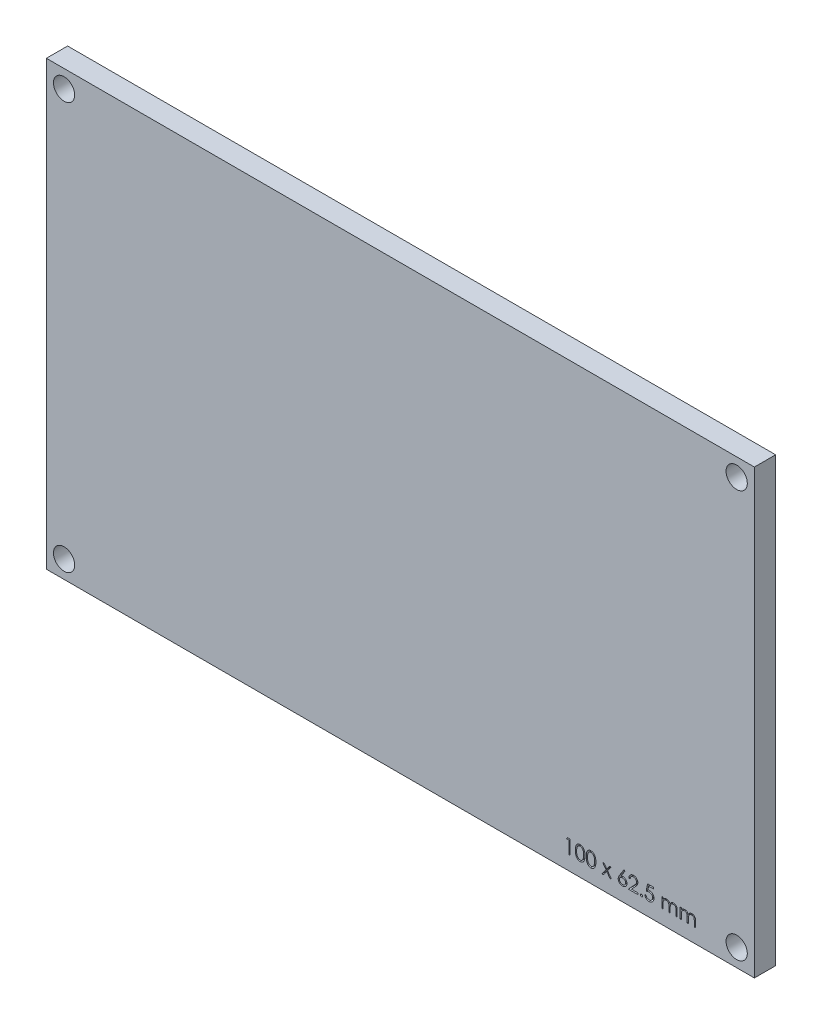
from build123d import *

# Parameters (mm, degrees)
SKETCH1_W               = 100
SKETCH1_H               = 62.5
BOSS_EXTRUDE1_DEPTH     = 3
CUT_EXTRUDE1_DEPTH      = 60.038652593
CUT_EXTRUDE1_DEPTH_BACK = 60.038652593
SKETCH2_R               = 1.5
CUT_EXTRUDE2_DEPTH      = 1


with BuildPart() as part:
    # Sketch1 → Boss-Extrude1 (new body)
    with BuildSketch(Plane.XY):
        Rectangle(SKETCH1_W, SKETCH1_H)
    extrude(amount=BOSS_EXTRUDE1_DEPTH)

    # Sketch2 → Cut-Extrude1 (cut, two sides: drawn at the far end of the back side and taken through both)
    with BuildSketch(Plane.XY.offset(3).offset(-CUT_EXTRUDE1_DEPTH_BACK)):
        with Locations((-47.5, 28.75)):
            Circle(SKETCH2_R)
        with Locations((-47.5, -28.75)):
            Circle(SKETCH2_R)
        with Locations((47.5, -28.75)):
            Circle(SKETCH2_R)
        with Locations((47.5, 28.75)):
            Circle(SKETCH2_R)
    extrude(amount=CUT_EXTRUDE1_DEPTH + CUT_EXTRUDE1_DEPTH_BACK, mode=Mode.SUBTRACT)

    # Sketch4 → Cut-Extrude2 (cut)
    # profile 1 of 10: a face of its own
    with BuildSketch(Plane.XY.offset(3)):
        Polygon((23.601670202, -27.27377154), (23.971461869, -27.27377154), (23.971461869, -29.27377154), (23.791974689, -29.27377154), (23.791974689, -27.478899745), (23.484282382, -27.478899745), align=None)
    # profile 2 of 10: a face of its own
    with BuildSketch(Plane.XY.offset(3)):
        with BuildLine():
            add(Edge.make_bspline(
                [(24.715051613, -28.274572822), (24.715239051, -28.242517172), (24.715603154, -28.18024861), (24.719653681, -28.089514528), (24.726382448, -28.004394363), (24.735603804, -27.92488404), (24.746825507, -27.850963032), (24.761805785, -27.782828885), (24.778841672, -27.720166252), (24.798585927, -27.662770796), (24.820864663, -27.609869251), (24.845112812, -27.560483422), (24.872292695, -27.514688032), (24.900850931, -27.471752152), (24.931943543, -27.432378612), (24.964685709, -27.396011376), (25.000355353, -27.363490948), (25.037739929, -27.333864489), (25.077177908, -27.307893362), (25.117545146, -27.285017512), (25.159119492, -27.26547473), (25.202014454, -27.250108767), (25.245844487, -27.237416855), (25.290762811, -27.228737456), (25.33684359, -27.223276365), (25.367947267, -27.22275427), (25.383721484, -27.222489489)],
                knots=[0, 0, 0, 0, 1.646270934, 3.197905019, 4.663502075, 6.030701355, 7.308322542, 8.50163776, 9.611534131, 10.641858119, 11.616356847, 12.558055219, 13.465016945, 14.349605745, 15.204443733, 16.039544428, 16.859896111, 17.680448484, 18.487036065, 19.28249412, 20.06191084, 20.843045899, 21.620316918, 22.403196591, 23.190181807, 24, 24, 24, 24], degree=3))
            add(Edge.make_bspline(
                [(25.383721484, -27.222489489), (25.399627472, -27.22276824), (25.431259477, -27.22332259), (25.478025406, -27.228650557), (25.523710938, -27.237491198), (25.568121303, -27.25001747), (25.611621295, -27.265557856), (25.653870671, -27.285036209), (25.695131861, -27.307709847), (25.734749168, -27.334352063), (25.77315752, -27.364056221), (25.809413498, -27.397634889), (25.843520405, -27.434749014), (25.875906293, -27.475001508), (25.905652349, -27.519164413), (25.933980025, -27.566469619), (25.959335474, -27.617744399), (25.983755288, -27.672133238), (26.004833566, -27.731141043), (26.023842849, -27.794435191), (26.03920226, -27.862763298), (26.05199613, -27.935766867), (26.061907499, -28.013714), (26.069126151, -28.096437609), (26.072939343, -28.183992118), (26.073657458, -28.243853746), (26.074025972, -28.274572822)],
                knots=[0, 0, 0, 0, 0.810914788, 1.612654377, 2.396697861, 3.181598691, 3.963628158, 4.749916497, 5.551656086, 6.361998678, 7.18212741, 8.025565596, 8.878627764, 9.750805457, 10.657531673, 11.591944965, 12.560506719, 13.57287815, 14.630710178, 15.753379473, 16.941251878, 18.199788006, 19.531962791, 20.947069417, 22.433333509, 24, 24, 24, 24], degree=3))
            add(Edge.make_bspline(
                [(26.074025972, -28.274572822), (26.073653637, -28.305157912), (26.07292816, -28.364751714), (26.069168899, -28.451912271), (26.061763967, -28.534196867), (26.052501116, -28.611802846), (26.039671995, -28.684407199), (26.023897614, -28.75226117), (26.006383144, -28.815657782), (25.984763261, -28.874077674), (25.961099998, -28.928335802), (25.935354172, -28.979002744), (25.907771414, -29.02652634), (25.877720703, -29.070526195), (25.845690181, -29.111313999), (25.810994302, -29.148169783), (25.77461111, -29.181981596), (25.73608973, -29.21206824), (25.695854557, -29.238402414), (25.654735085, -29.261953186), (25.612001723, -29.280943297), (25.568622893, -29.297249035), (25.523978112, -29.309706436), (25.478123032, -29.318320068), (25.431290897, -29.324361124), (25.39963286, -29.32482197), (25.383721484, -29.325053591)],
                knots=[0, 0, 0, 0, 1.561518951, 3.042555995, 4.452378317, 5.7783523, 7.031515105, 8.214008947, 9.334062868, 10.386615937, 11.391082383, 12.354592575, 13.286541444, 14.194233754, 15.072674879, 15.931287219, 16.775624067, 17.606195743, 18.42308326, 19.229000347, 20.022332153, 20.807536673, 21.593273796, 22.3848459, 23.188221202, 24, 24, 24, 24], degree=3))
            add(Edge.make_bspline(
                [(25.383721484, -29.325053591), (25.367947705, -29.324787103), (25.336844891, -29.324261639), (25.290757791, -29.318825221), (25.246024966, -29.310084933), (25.202425678, -29.297846874), (25.15973624, -29.282866967), (25.118538362, -29.263350577), (25.078373972, -29.240873966), (25.039350225, -29.215276582), (25.002200419, -29.185949906), (24.966715502, -29.15351317), (24.933786919, -29.117156935), (24.903138865, -29.077455264), (24.874010814, -29.034773411), (24.847216887, -28.988528627), (24.822433542, -28.938904278), (24.799780118, -28.885579758), (24.779695168, -28.827776942), (24.76195362, -28.764834554), (24.74794553, -28.696197048), (24.73595527, -28.622415695), (24.726284194, -28.543173449), (24.719681722, -28.45842729), (24.715600971, -28.368230028), (24.715238074, -28.306361585), (24.715051613, -28.274572822)],
                knots=[0, 0, 0, 0, 0.810891512, 1.598919785, 2.382837074, 3.152667961, 3.926044502, 4.706494248, 5.493654104, 6.291793342, 7.103789334, 7.925228297, 8.761435821, 9.622817696, 10.50288917, 11.416980706, 12.369136599, 13.353924996, 14.394355917, 15.514179734, 16.714354668, 17.994756427, 19.357759367, 20.818452758, 22.365282078, 24, 24, 24, 24], degree=3))
        make_face()
        with BuildLine():
            add(Edge.make_bspline(
                [(24.894538792, -28.27377154), (24.894607047, -28.300485082), (24.894739518, -28.352330822), (24.898200204, -28.427669828), (24.902914622, -28.497938588), (24.908995364, -28.563226323), (24.91802562, -28.623312044), (24.928143784, -28.678609006), (24.940456978, -28.72882457), (24.95502556, -28.774303319), (24.97161933, -28.815817073), (24.989736966, -28.854446338), (25.009200236, -28.890647445), (25.030982608, -28.924095221), (25.054705501, -28.954898743), (25.079833078, -28.983603219), (25.107303126, -29.009201494), (25.145305265, -29.039902554), (25.195474679, -29.071627773), (25.258686367, -29.09925411), (25.323639768, -29.116615514), (25.367726197, -29.118823375), (25.3897311, -29.119925386)],
                knots=[0, 0, 0, 0, 1.459021318, 2.831673884, 4.118529203, 5.306027144, 6.411944654, 7.436330062, 8.375795394, 9.233974572, 10.042671642, 10.816086306, 11.563610507, 12.285937304, 12.993564865, 13.685989202, 14.367179055, 15.041617293, 16.353048772, 17.594441528, 18.799311195, 20, 20, 20, 20], degree=3))
            add(Edge.make_bspline(
                [(25.3897311, -29.119925386), (25.411878341, -29.119012369), (25.456127097, -29.117188219), (25.52077498, -29.09958894), (25.583535134, -29.073034917), (25.6327191, -29.041636343), (25.670137696, -29.01173444), (25.696947405, -28.986240356), (25.72155429, -28.957694146), (25.744892618, -28.926894548), (25.766297804, -28.893253129), (25.785762454, -28.856931657), (25.803524367, -28.81782927), (25.813643822, -28.790532276), (25.818817638, -28.776576027)],
                knots=[0, 0, 0, 0, 1.353760809, 2.704726607, 4.075137775, 5.516104923, 6.260822281, 7.007110065, 7.778089737, 8.566572457, 9.372053459, 10.217411131, 11.088608312, 12, 12, 12, 12], degree=3))
            add(Edge.make_bspline(
                [(25.818817638, -28.776576027), (25.82484722, -28.758730462), (25.837089856, -28.722496311), (25.852868013, -28.66628851), (25.865293955, -28.607315502), (25.876473022, -28.545929721), (25.884103339, -28.481678463), (25.890244947, -28.414760529), (25.893862482, -28.345125465), (25.894310911, -28.297814042), (25.894538792, -28.27377154)],
                knots=[0, 0, 0, 0, 0.884706709, 1.796334032, 2.740027952, 3.714592787, 4.726048262, 5.777819803, 6.87074269, 8, 8, 8, 8], degree=3))
            add(Edge.make_bspline(
                [(25.894538792, -28.27377154), (25.894224398, -28.249732927), (25.893609377, -28.202708262), (25.891258526, -28.13384073), (25.885187912, -28.068430581), (25.878445559, -28.006196025), (25.86850429, -27.947481566), (25.857785543, -27.891795678), (25.84338485, -27.839828235), (25.828002122, -27.790765617), (25.810396181, -27.745165243), (25.791015762, -27.702814508), (25.770317614, -27.663508951), (25.747836334, -27.627356413), (25.7238388, -27.59419496), (25.697691629, -27.564689477), (25.670431988, -27.537925495), (25.632250739, -27.507375456), (25.58226543, -27.476225915), (25.520067918, -27.447559767), (25.455341835, -27.431097885), (25.411585576, -27.428776921), (25.3897311, -27.427617694)],
                knots=[0, 0, 0, 0, 1.31362396, 2.569729283, 3.763502607, 4.902122613, 5.988968491, 7.01645872, 7.998833611, 8.933434873, 9.825090667, 10.667526885, 11.477055099, 12.250526234, 12.991942729, 13.710640831, 14.402115721, 15.076753259, 16.378508321, 17.609869233, 18.806226677, 20, 20, 20, 20], degree=3))
            add(Edge.make_bspline(
                [(25.3897311, -27.427617694), (25.367610761, -27.428778521), (25.323329787, -27.431102289), (25.257930955, -27.447498434), (25.195242755, -27.476077271), (25.145389626, -27.507478627), (25.107181748, -27.537386234), (25.080277352, -27.56332135), (25.055050968, -27.591690638), (25.031812282, -27.622777447), (25.010046977, -27.656186228), (24.990057827, -27.692179808), (24.972047925, -27.730940588), (24.95542819, -27.772435694), (24.940815168, -27.817910519), (24.928761475, -27.86806423), (24.917626016, -27.923185311), (24.909743005, -27.983596458), (24.902735144, -28.048900546), (24.898231517, -28.119344727), (24.894727941, -28.194810088), (24.894603105, -28.246923893), (24.894538792, -28.27377154)],
                knots=[0, 0, 0, 0, 1.207732386, 2.417664972, 3.655092373, 4.956220595, 5.625982001, 6.301752483, 6.994047911, 7.697131622, 8.419323945, 9.170223765, 9.943494443, 10.752040957, 11.610060368, 12.549350801, 13.567764191, 14.679664412, 15.874934091, 17.154273443, 18.533957287, 20, 20, 20, 20], degree=3))
        make_face(mode=Mode.SUBTRACT)
    # profile 3 of 10: a face of its own
    with BuildSketch(Plane.XY.offset(3)):
        with BuildLine():
            add(Edge.make_bspline(
                [(26.253513151, -28.274572822), (26.25370059, -28.242517172), (26.254064693, -28.18024861), (26.258115219, -28.089514528), (26.264843986, -28.004394363), (26.274065342, -27.92488404), (26.285287045, -27.850963032), (26.300267323, -27.782828885), (26.31730321, -27.720166252), (26.337047465, -27.662770796), (26.359326202, -27.609869251), (26.383574351, -27.560483422), (26.410754233, -27.514688032), (26.439312469, -27.471752152), (26.470405081, -27.432378612), (26.503147247, -27.396011376), (26.538816891, -27.363490948), (26.576201467, -27.333864489), (26.615639447, -27.307893362), (26.656006685, -27.285017512), (26.697581031, -27.26547473), (26.740475992, -27.250108767), (26.784306026, -27.237416855), (26.829224349, -27.228737456), (26.875305129, -27.223276365), (26.906408806, -27.22275427), (26.922183023, -27.222489489)],
                knots=[0, 0, 0, 0, 1.646270934, 3.197905019, 4.663502075, 6.030701355, 7.308322542, 8.50163776, 9.611534131, 10.641858119, 11.616356847, 12.558055219, 13.465016945, 14.349605745, 15.204443733, 16.039544428, 16.859896111, 17.680448484, 18.487036065, 19.28249412, 20.06191084, 20.843045899, 21.620316918, 22.403196591, 23.190181807, 24, 24, 24, 24], degree=3))
            add(Edge.make_bspline(
                [(26.922183023, -27.222489489), (26.93808901, -27.22276824), (26.969721016, -27.22332259), (27.016486944, -27.228650557), (27.062172477, -27.237491198), (27.106582842, -27.25001747), (27.150082834, -27.265557856), (27.19233221, -27.285036209), (27.233593399, -27.307709847), (27.273210706, -27.334352063), (27.311619058, -27.364056221), (27.347875037, -27.397634889), (27.381981943, -27.434749014), (27.414367832, -27.475001508), (27.444113887, -27.519164413), (27.472441563, -27.566469619), (27.497797012, -27.617744399), (27.522216826, -27.672133238), (27.543295105, -27.731141043), (27.562304388, -27.794435191), (27.577663798, -27.862763298), (27.590457668, -27.935766867), (27.600369037, -28.013714), (27.60758769, -28.096437609), (27.611400881, -28.183992118), (27.612118996, -28.243853746), (27.61248751, -28.274572822)],
                knots=[0, 0, 0, 0, 0.810914788, 1.612654377, 2.396697861, 3.181598691, 3.963628158, 4.749916497, 5.551656086, 6.361998678, 7.18212741, 8.025565596, 8.878627764, 9.750805457, 10.657531673, 11.591944965, 12.560506719, 13.57287815, 14.630710178, 15.753379473, 16.941251878, 18.199788006, 19.531962791, 20.947069417, 22.433333509, 24, 24, 24, 24], degree=3))
            add(Edge.make_bspline(
                [(27.61248751, -28.274572822), (27.612115176, -28.305157912), (27.611389698, -28.364751714), (27.607630437, -28.451912271), (27.600225505, -28.534196867), (27.590962655, -28.611802846), (27.578133533, -28.684407199), (27.562359152, -28.75226117), (27.544844682, -28.815657782), (27.5232248, -28.874077674), (27.499561537, -28.928335802), (27.47381571, -28.979002744), (27.446232953, -29.02652634), (27.416182241, -29.070526195), (27.384151719, -29.111313999), (27.34945584, -29.148169783), (27.313072649, -29.181981596), (27.274551268, -29.21206824), (27.234316096, -29.238402414), (27.193196623, -29.261953186), (27.150463261, -29.280943297), (27.107084431, -29.297249035), (27.062439651, -29.309706436), (27.01658457, -29.318320068), (26.969752435, -29.324361124), (26.938094398, -29.32482197), (26.922183023, -29.325053591)],
                knots=[0, 0, 0, 0, 1.561518951, 3.042555995, 4.452378317, 5.7783523, 7.031515105, 8.214008947, 9.334062868, 10.386615937, 11.391082383, 12.354592575, 13.286541444, 14.194233754, 15.072674879, 15.931287219, 16.775624067, 17.606195743, 18.42308326, 19.229000347, 20.022332153, 20.807536673, 21.593273796, 22.3848459, 23.188221202, 24, 24, 24, 24], degree=3))
            add(Edge.make_bspline(
                [(26.922183023, -29.325053591), (26.906409243, -29.324787103), (26.875306429, -29.324261639), (26.829219329, -29.318825221), (26.784486504, -29.310084933), (26.740887216, -29.297846874), (26.698197779, -29.282866967), (26.656999901, -29.263350577), (26.61683551, -29.240873966), (26.577811764, -29.215276582), (26.540661958, -29.185949906), (26.50517704, -29.15351317), (26.472248458, -29.117156935), (26.441600403, -29.077455264), (26.412472353, -29.034773411), (26.385678425, -28.988528627), (26.36089508, -28.938904278), (26.338241657, -28.885579758), (26.318156706, -28.827776942), (26.300415159, -28.764834554), (26.286407069, -28.696197048), (26.274416809, -28.622415695), (26.264745733, -28.543173449), (26.258143261, -28.45842729), (26.254062509, -28.368230028), (26.253699612, -28.306361585), (26.253513151, -28.274572822)],
                knots=[0, 0, 0, 0, 0.810891512, 1.598919785, 2.382837074, 3.152667961, 3.926044502, 4.706494248, 5.493654104, 6.291793342, 7.103789334, 7.925228297, 8.761435821, 9.622817696, 10.50288917, 11.416980706, 12.369136599, 13.353924996, 14.394355917, 15.514179734, 16.714354668, 17.994756427, 19.357759367, 20.818452758, 22.365282078, 24, 24, 24, 24], degree=3))
        make_face()
        with BuildLine():
            add(Edge.make_bspline(
                [(26.43300033, -28.27377154), (26.433068586, -28.300485082), (26.433201056, -28.352330822), (26.436661742, -28.427669828), (26.441376161, -28.497938588), (26.447456902, -28.563226323), (26.456487158, -28.623312044), (26.466605323, -28.678609006), (26.478918517, -28.72882457), (26.493487098, -28.774303319), (26.510080868, -28.815817073), (26.528198504, -28.854446338), (26.547661775, -28.890647445), (26.569444146, -28.924095221), (26.59316704, -28.954898743), (26.618294616, -28.983603219), (26.645764665, -29.009201494), (26.683766803, -29.039902554), (26.733936217, -29.071627773), (26.797147906, -29.09925411), (26.862101306, -29.116615514), (26.906187735, -29.118823375), (26.928192638, -29.119925386)],
                knots=[0, 0, 0, 0, 1.459021318, 2.831673884, 4.118529203, 5.306027144, 6.411944654, 7.436330062, 8.375795394, 9.233974572, 10.042671642, 10.816086306, 11.563610507, 12.285937304, 12.993564865, 13.685989202, 14.367179055, 15.041617293, 16.353048772, 17.594441528, 18.799311195, 20, 20, 20, 20], degree=3))
            add(Edge.make_bspline(
                [(26.928192638, -29.119925386), (26.950339879, -29.119012369), (26.994588635, -29.117188219), (27.059236518, -29.09958894), (27.121996673, -29.073034917), (27.171180638, -29.041636343), (27.208599235, -29.01173444), (27.235408943, -28.986240356), (27.260015828, -28.957694146), (27.283354157, -28.926894548), (27.304759343, -28.893253129), (27.324223993, -28.856931657), (27.341985906, -28.81782927), (27.352105361, -28.790532276), (27.357279177, -28.776576027)],
                knots=[0, 0, 0, 0, 1.353760809, 2.704726607, 4.075137775, 5.516104923, 6.260822281, 7.007110065, 7.778089737, 8.566572457, 9.372053459, 10.217411131, 11.088608312, 12, 12, 12, 12], degree=3))
            add(Edge.make_bspline(
                [(27.357279177, -28.776576027), (27.363308758, -28.758730462), (27.375551395, -28.722496311), (27.391329551, -28.66628851), (27.403755494, -28.607315502), (27.41493456, -28.545929721), (27.422564878, -28.481678463), (27.428706485, -28.414760529), (27.432324021, -28.345125465), (27.43277245, -28.297814042), (27.43300033, -28.27377154)],
                knots=[0, 0, 0, 0, 0.884706709, 1.796334032, 2.740027952, 3.714592787, 4.726048262, 5.777819803, 6.87074269, 8, 8, 8, 8], degree=3))
            add(Edge.make_bspline(
                [(27.43300033, -28.27377154), (27.432685937, -28.249732927), (27.432070915, -28.202708262), (27.429720065, -28.13384073), (27.423649451, -28.068430581), (27.416907097, -28.006196025), (27.406965828, -27.947481566), (27.396247081, -27.891795678), (27.381846389, -27.839828235), (27.36646366, -27.790765617), (27.34885772, -27.745165243), (27.3294773, -27.702814508), (27.308779152, -27.663508951), (27.286297872, -27.627356413), (27.262300339, -27.59419496), (27.236153168, -27.564689477), (27.208893526, -27.537925495), (27.170712277, -27.507375456), (27.120726969, -27.476225915), (27.058529456, -27.447559767), (26.993803374, -27.431097885), (26.950047114, -27.428776921), (26.928192638, -27.427617694)],
                knots=[0, 0, 0, 0, 1.31362396, 2.569729283, 3.763502607, 4.902122613, 5.988968491, 7.01645872, 7.998833611, 8.933434873, 9.825090667, 10.667526885, 11.477055099, 12.250526234, 12.991942729, 13.710640831, 14.402115721, 15.076753259, 16.378508321, 17.609869233, 18.806226677, 20, 20, 20, 20], degree=3))
            add(Edge.make_bspline(
                [(26.928192638, -27.427617694), (26.9060723, -27.428778521), (26.861791325, -27.431102289), (26.796392494, -27.447498434), (26.733704293, -27.476077271), (26.683851165, -27.507478627), (26.645643287, -27.537386234), (26.61873889, -27.56332135), (26.593512506, -27.591690638), (26.57027382, -27.622777447), (26.548508516, -27.656186228), (26.528519366, -27.692179808), (26.510509463, -27.730940588), (26.493889728, -27.772435694), (26.479276706, -27.817910519), (26.467223013, -27.86806423), (26.456087554, -27.923185311), (26.448204543, -27.983596458), (26.441196683, -28.048900546), (26.436693056, -28.119344727), (26.43318948, -28.194810088), (26.433064643, -28.246923893), (26.43300033, -28.27377154)],
                knots=[0, 0, 0, 0, 1.207732386, 2.417664972, 3.655092373, 4.956220595, 5.625982001, 6.301752483, 6.994047911, 7.697131622, 8.419323945, 9.170223765, 9.943494443, 10.752040957, 11.610060368, 12.549350801, 13.567764191, 14.679664412, 15.874934091, 17.154273443, 18.533957287, 20, 20, 20, 20], degree=3))
        make_face(mode=Mode.SUBTRACT)
    # profile 4 of 10: a face of its own
    with BuildSketch(Plane.XY.offset(3)):
        Polygon((28.561205459, -27.812233079), (28.774747125, -27.812233079), (29.150949048, -28.339476668), (29.527150972, -27.812233079), (29.740692638, -27.812233079), (29.257920202, -28.488915771), (29.817615715, -29.27377154), (29.604074048, -29.27377154), (29.150949048, -28.638755515), (28.697824048, -29.27377154), (28.484282382, -29.27377154), (29.044378536, -28.488915771), align=None)
    # profile 5 of 10: a face of its own
    with BuildSketch(Plane.XY.offset(3)):
        with BuildLine():
            Line((31.586846484, -27.222489489), (31.725067638, -27.331063207))
            Line((31.725067638, -27.331063207), (31.196622125, -28.139156156))
            add(Edge.make_bspline(
                [(31.196622125, -28.139156156), (31.231805141, -28.133548235), (31.30043359, -28.122609352), (31.369899818, -28.120804812), (31.403753536, -28.119925386)],
                knots=[0, 0, 0, 0, 1.025318673, 2, 2, 2, 2], degree=3))
            add(Edge.make_bspline(
                [(31.403753536, -28.119925386), (31.424080676, -28.120471736), (31.464094048, -28.121547209), (31.522840792, -28.129823695), (31.579291613, -28.142866616), (31.633212534, -28.161879334), (31.684797095, -28.186166393), (31.734341321, -28.215274319), (31.780913899, -28.250706136), (31.825114572, -28.290286111), (31.865244342, -28.334124388), (31.900773517, -28.380639438), (31.930617398, -28.429782798), (31.954831067, -28.481529579), (31.973633855, -28.535800013), (31.987341081, -28.592524664), (31.995443705, -28.651742648), (31.996543986, -28.692015891), (31.997102895, -28.712473463)],
                knots=[0, 0, 0, 0, 1.04369286, 2.054478336, 3.041073146, 4.015093852, 4.984733326, 5.965804835, 6.960378782, 7.985147595, 9.009457201, 10.008161701, 10.986880575, 11.956520048, 12.937015923, 13.931873656, 14.949455224, 16, 16, 16, 16], degree=3))
            add(Edge.make_bspline(
                [(31.997102895, -28.712473463), (31.996289692, -28.740461866), (31.994689501, -28.795536417), (31.978744475, -28.875751678), (31.953967535, -28.952170259), (31.918551804, -29.023572071), (31.874561871, -29.089859253), (31.820917533, -29.148593805), (31.759521254, -29.200976684), (31.690100226, -29.244780466), (31.615389961, -29.280553638), (31.536903105, -29.306248062), (31.455401879, -29.322067187), (31.40008496, -29.324050389), (31.372102895, -29.325053591)],
                knots=[0, 0, 0, 0, 1.031375318, 2.029502543, 3.004789286, 3.987476834, 4.960371455, 5.9300674, 6.912260825, 7.929083631, 8.949397511, 9.960523116, 10.96833055, 12, 12, 12, 12], degree=3))
            add(Edge.make_bspline(
                [(31.372102895, -29.325053591), (31.345190494, -29.324180331), (31.291881741, -29.322450555), (31.213463002, -29.307041448), (31.138112706, -29.28206596), (31.066358774, -29.247657801), (30.999889852, -29.204196154), (30.940423774, -29.151874851), (30.888257046, -29.0918123), (30.844842977, -29.024017816), (30.810409416, -28.951166412), (30.784586601, -28.875202322), (30.769503034, -28.796402333), (30.767395287, -28.742984539), (30.766333664, -28.716079232)],
                knots=[0, 0, 0, 0, 1.012016664, 2.004627821, 2.994792927, 3.992885782, 4.990978636, 5.973936114, 6.964471063, 7.975201453, 8.993600317, 9.990122807, 10.98767138, 12, 12, 12, 12], degree=3))
            add(Edge.make_bspline(
                [(30.766333664, -28.716079232), (30.767008775, -28.695482328), (30.768387224, -28.653427384), (30.778012018, -28.589733654), (30.793477615, -28.524561607), (30.810797756, -28.469273496), (30.829098105, -28.423981198), (30.844328127, -28.387464918), (30.863284696, -28.349887161), (30.883498057, -28.309959369), (30.906787697, -28.268710551), (30.932110925, -28.225451311), (30.960167868, -28.180869638), (30.979836533, -28.150615812), (30.989891356, -28.135149745)],
                knots=[0, 0, 0, 0, 1.173818275, 2.396712641, 3.66331629, 4.989737886, 5.693666774, 6.447286557, 7.243889047, 8.091586357, 8.998013824, 9.943181721, 10.948533338, 12, 12, 12, 12], degree=3))
            Line((30.989891356, -28.135149745), (31.586846484, -27.222489489))
        make_face()
        with BuildLine():
            add(Edge.make_bspline(
                [(31.366093279, -28.325053591), (31.350857711, -28.325498188), (31.32109822, -28.326366614), (31.27743684, -28.331409615), (31.236114982, -28.340906224), (31.196585191, -28.353001271), (31.159586504, -28.36963159), (31.124850024, -28.389832618), (31.092241423, -28.413616149), (31.06210225, -28.440645241), (31.034776728, -28.470238403), (31.011244654, -28.501935272), (30.990946139, -28.53497196), (30.974442243, -28.569624498), (30.961590771, -28.605879641), (30.952294628, -28.643570641), (30.947121056, -28.682950244), (30.946260352, -28.709654531), (30.945820843, -28.723290771)],
                knots=[0, 0, 0, 0, 1.129588631, 2.206414736, 3.251139165, 4.268635594, 5.265702196, 6.250456724, 7.242448911, 8.251968645, 9.246821453, 10.222880186, 11.173611482, 12.116736599, 13.062300278, 14.020270554, 14.989073742, 16, 16, 16, 16], degree=3))
            add(Edge.make_bspline(
                [(30.945820843, -28.723290771), (30.946178764, -28.736805045), (30.946880594, -28.763304525), (30.953253348, -28.802355485), (30.962987681, -28.839935432), (30.977467907, -28.875850632), (30.994740414, -28.910648528), (31.017543457, -28.943068691), (31.042810191, -28.975080159), (31.073012439, -29.004223857), (31.105425789, -29.031341928), (31.140055048, -29.05504493), (31.176146454, -29.075322744), (31.214187266, -29.0912148), (31.253637771, -29.104257249), (31.294826659, -29.113435237), (31.337782577, -29.118624109), (31.366880827, -29.119485934), (31.381718279, -29.119925386)],
                knots=[0, 0, 0, 0, 0.989467248, 1.94019797, 2.891935182, 3.827694429, 4.772920941, 5.730924762, 6.725747692, 7.756678648, 8.79901574, 9.819492441, 10.826891316, 11.826466727, 12.835195252, 13.867842842, 14.912794438, 16, 16, 16, 16], degree=3))
            add(Edge.make_bspline(
                [(31.381718279, -29.119925386), (31.396555707, -29.1194859), (31.42565391, -29.118624007), (31.468610173, -29.113435625), (31.509797783, -29.104255826), (31.549252931, -29.091219958), (31.587276606, -29.075303609), (31.623336447, -29.055171084), (31.657638214, -29.031196159), (31.690072843, -29.0042702), (31.720149379, -28.974914285), (31.74602211, -28.943354443), (31.768126814, -28.910386503), (31.786089207, -28.875987709), (31.800409945, -28.839913716), (31.810193641, -28.802361302), (31.816553234, -28.763303002), (31.817256872, -28.736804531), (31.817615715, -28.723290771)],
                knots=[0, 0, 0, 0, 1.087397944, 2.132534446, 3.165364764, 4.174271784, 5.174024072, 6.181601208, 7.194203697, 8.236725232, 9.267838612, 10.269026844, 11.221737037, 12.171628256, 13.107553087, 14.05945871, 15.010357665, 16, 16, 16, 16], degree=3))
            add(Edge.make_bspline(
                [(31.817615715, -28.723290771), (31.817301262, -28.709636742), (31.816684093, -28.682838323), (31.809703551, -28.643588256), (31.800022194, -28.605688138), (31.785403319, -28.569376167), (31.766411008, -28.534795637), (31.743277633, -28.501771865), (31.716516164, -28.470051667), (31.685603284, -28.440587205), (31.651951722, -28.413646017), (31.616171387, -28.389863414), (31.57873826, -28.369791998), (31.539690293, -28.353045083), (31.498580074, -28.340959669), (31.456071309, -28.33144353), (31.411620313, -28.32637952), (31.381462251, -28.325501197), (31.366093279, -28.325053591)],
                knots=[0, 0, 0, 0, 0.978206639, 1.919901502, 2.851605144, 3.780102724, 4.718870031, 5.675451981, 6.667674623, 7.690630536, 8.733308323, 9.756129687, 10.767539656, 11.776269907, 12.797430371, 13.836405707, 14.897401972, 16, 16, 16, 16], degree=3))
        make_face(mode=Mode.SUBTRACT)
    # profile 6 of 10: a face of its own
    with BuildSketch(Plane.XY.offset(3)):
        with BuildLine():
            Line((32.458641356, -27.889156156), (32.279154177, -27.889156156))
            add(Edge.make_bspline(
                [(32.279154177, -27.889156156), (32.280323978, -27.86534422), (32.282621438, -27.818578211), (32.29338046, -27.750393122), (32.308775247, -27.685218951), (32.330541792, -27.623579), (32.357573951, -27.564928253), (32.38999111, -27.509499673), (32.428387596, -27.457504708), (32.471934301, -27.409425369), (32.519230666, -27.365318186), (32.570262631, -27.327229476), (32.623888361, -27.295047949), (32.679945161, -27.268144382), (32.739065483, -27.247950185), (32.80071283, -27.232966391), (32.865158051, -27.223951336), (32.909066635, -27.222982316), (32.931397766, -27.222489489)],
                knots=[0, 0, 0, 0, 1.10065271, 2.161652631, 3.183658789, 4.190468796, 5.17591951, 6.163126047, 7.15150782, 8.156236427, 9.156009102, 10.134482811, 11.092018607, 12.041330605, 13.001268258, 13.972401359, 14.968799086, 16, 16, 16, 16], degree=3))
            add(Edge.make_bspline(
                [(32.931397766, -27.222489489), (32.953328094, -27.223002893), (32.996420406, -27.224011712), (33.059312985, -27.232675158), (33.119185725, -27.246244067), (33.175921592, -27.265281448), (33.229067914, -27.290872549), (33.27902394, -27.321614), (33.326384403, -27.357168189), (33.369016851, -27.399027511), (33.408164325, -27.443714588), (33.441937042, -27.491421962), (33.47085885, -27.540695839), (33.494966095, -27.591911954), (33.51271246, -27.645552542), (33.526185722, -27.700836658), (33.533801387, -27.75833655), (33.5349702, -27.797254582), (33.535564433, -27.817040771)],
                knots=[0, 0, 0, 0, 1.111607364, 2.184268762, 3.212621178, 4.221274766, 5.211760367, 6.196651075, 7.1921475, 8.207485113, 9.220403448, 10.201281604, 11.166441695, 12.114753415, 13.065576456, 14.026450734, 14.996634279, 16, 16, 16, 16], degree=3))
            add(Edge.make_bspline(
                [(33.535564433, -27.817040771), (33.534596854, -27.844896676), (33.532678676, -27.900119656), (33.516270461, -27.981271006), (33.490643883, -28.059895817), (33.459788251, -28.123174275), (33.42866114, -28.174164843), (33.400611136, -28.21614696), (33.367774101, -28.261350085), (33.329672102, -28.309622849), (33.287093318, -28.361343366), (33.239652082, -28.416480392), (33.187010092, -28.474464261), (33.150062377, -28.514067461), (33.130916997, -28.534588848)],
                knots=[0, 0, 0, 0, 1.184426356, 2.348067706, 3.509069118, 4.696110526, 5.333549288, 6.050745305, 6.844228056, 7.710549037, 8.667450064, 9.695053472, 10.805634456, 12, 12, 12, 12], degree=3))
            Line((33.130916997, -28.534588848), (32.630516356, -29.068643335))
            Line((32.630516356, -29.068643335), (33.561205459, -29.068643335))
            Line((33.561205459, -29.068643335), (33.561205459, -29.27377154))
            Line((33.561205459, -29.27377154), (32.2022311, -29.27377154))
            Line((32.2022311, -29.27377154), (32.977872125, -28.446047181))
            add(Edge.make_bspline(
                [(32.977872125, -28.446047181), (32.996756632, -28.426333863), (33.033029905, -28.388468614), (33.084334234, -28.333186922), (33.130413656, -28.28190147), (33.171566452, -28.234709157), (33.206899884, -28.19091969), (33.238255445, -28.151951288), (33.26337864, -28.116091602), (33.29064458, -28.074525537), (33.317052569, -28.023775641), (33.339745344, -27.96175639), (33.353582401, -27.897912246), (33.355242307, -27.854768224), (33.356077254, -27.833066412)],
                knots=[0, 0, 0, 0, 1.329631726, 2.553950428, 3.673215718, 4.687767853, 5.603093632, 6.413772471, 7.123043292, 7.734684054, 8.834405432, 9.900288307, 10.943827018, 12, 12, 12, 12], degree=3))
            add(Edge.make_bspline(
                [(33.356077254, -27.833066412), (33.355713972, -27.819419899), (33.354998015, -27.792525241), (33.34867933, -27.753093379), (33.33913047, -27.715056342), (33.325447465, -27.678297132), (33.307386471, -27.64318533), (33.285401682, -27.609678199), (33.260035932, -27.577284504), (33.230692349, -27.546911191), (33.198457195, -27.51909336), (33.164403338, -27.494451025), (33.128374707, -27.473857247), (33.090523209, -27.456975249), (33.050954369, -27.443732174), (33.009591658, -27.434555843), (32.966549363, -27.428794424), (32.937158794, -27.428014897), (32.922183023, -27.427617694)],
                knots=[0, 0, 0, 0, 0.991446411, 1.95395049, 2.89581595, 3.838931463, 4.798493298, 5.75982156, 6.748411868, 7.785213223, 8.824556874, 9.840280684, 10.836137867, 11.835679398, 12.848801643, 13.863922112, 14.911575587, 16, 16, 16, 16], degree=3))
            add(Edge.make_bspline(
                [(32.922183023, -27.427617694), (32.906542547, -27.428026284), (32.875827235, -27.428828687), (32.830730645, -27.434441638), (32.7877102, -27.444124975), (32.746657684, -27.457368789), (32.707503635, -27.474202246), (32.670438467, -27.495168957), (32.635545388, -27.520188096), (32.602758803, -27.548554128), (32.572550815, -27.580135614), (32.546009743, -27.615341308), (32.522818878, -27.653528402), (32.50258503, -27.694593859), (32.486153207, -27.738910305), (32.473597121, -27.786320422), (32.46366178, -27.836618354), (32.460342626, -27.871352689), (32.458641356, -27.889156156)],
                knots=[0, 0, 0, 0, 1.031018746, 2.02475058, 2.990194455, 3.934040569, 4.864654155, 5.795059489, 6.735614925, 7.690564532, 8.649604399, 9.611025574, 10.590972636, 11.591080095, 12.624614302, 13.701020113, 14.821632451, 16, 16, 16, 16], degree=3))
        make_face()
    # profile 7 of 10: a face of its own
    with BuildSketch(Plane.XY.offset(3)):
        with BuildLine():
            add(Edge.make_bspline(
                [(34.061205459, -28.966079232), (34.072342723, -28.966741042), (34.094176027, -28.968038442), (34.125741243, -28.976939399), (34.15430962, -28.992744348), (34.179756617, -29.013808792), (34.200731747, -29.039349171), (34.217099948, -29.06768969), (34.225923368, -29.099519172), (34.227211318, -29.121478986), (34.227872125, -29.132745899)],
                knots=[0, 0, 0, 0, 1.020151414, 1.999887582, 2.974338812, 3.990962822, 5.007586832, 5.987933904, 6.967670073, 8, 8, 8, 8], degree=3))
            add(Edge.make_bspline(
                [(34.227872125, -29.132745899), (34.227188925, -29.143742088), (34.225841664, -29.16542641), (34.217120173, -29.197015817), (34.200607002, -29.225374048), (34.179901292, -29.251260984), (34.15430333, -29.272370053), (34.125673703, -29.288040536), (34.094250127, -29.29757881), (34.072355085, -29.298793837), (34.061205459, -29.299412566)],
                knots=[0, 0, 0, 0, 1.009421747, 1.99056486, 2.972319754, 3.999869655, 5.017953583, 5.993804169, 6.978383603, 8, 8, 8, 8], degree=3))
            add(Edge.make_bspline(
                [(34.061205459, -29.299412566), (34.050047798, -29.298816225), (34.028265123, -29.29765201), (33.99695884, -29.287844692), (33.968154858, -29.272517001), (33.94256188, -29.251221624), (33.921682753, -29.225507256), (33.90589682, -29.196820515), (33.896416735, -29.165516837), (33.895169951, -29.143759898), (33.894538792, -29.132745899)],
                knots=[0, 0, 0, 0, 1.022052826, 1.995314843, 2.982371812, 4.00089066, 5.028879526, 6.005146991, 6.990147033, 8, 8, 8, 8], degree=3))
            add(Edge.make_bspline(
                [(33.894538792, -29.132745899), (33.895145706, -29.121460539), (33.896330631, -29.099427259), (33.905916722, -29.067884912), (33.921560272, -29.039217233), (33.942706212, -29.013847758), (33.968148667, -28.992597871), (33.996889355, -28.977132275), (34.028340521, -28.967966325), (34.050060486, -28.966719173), (34.061205459, -28.966079232)],
                knots=[0, 0, 0, 0, 1.032775665, 2.016367738, 2.991239715, 4.008302682, 5.025365648, 6.011011707, 6.979408107, 8, 8, 8, 8], degree=3))
        make_face()
    # profile 8 of 10: a face of its own
    with BuildSketch(Plane.XY.offset(3)):
        with BuildLine():
            Line((35.740692638, -27.27377154), (35.740692638, -27.478899745))
            Line((35.740692638, -27.478899745), (35.060404177, -27.478899745))
            Line((35.060404177, -27.478899745), (34.952631741, -28.004941412))
            add(Edge.make_bspline(
                [(34.952631741, -28.004941412), (34.973806526, -27.999095542), (35.014829324, -27.987770095), (35.075377816, -27.975195369), (35.132859075, -27.967615115), (35.170159286, -27.96658008), (35.188208664, -27.966079232)],
                knots=[0, 0, 0, 0, 1.100273476, 2.13160584, 3.095893838, 4, 4, 4, 4], degree=3))
            add(Edge.make_bspline(
                [(35.188208664, -27.966079232), (35.210542229, -27.966562624), (35.254455599, -27.967513093), (35.318706426, -27.976639865), (35.380039508, -27.99100553), (35.438326577, -28.0110744), (35.493675463, -28.036737104), (35.545576926, -28.068794213), (35.59481002, -28.106241831), (35.640491502, -28.149296123), (35.681933964, -28.196679904), (35.718371672, -28.247627259), (35.749321724, -28.301643066), (35.774213584, -28.359243414), (35.794090346, -28.419791502), (35.807320057, -28.483924406), (35.816129605, -28.551037617), (35.817113826, -28.596925943), (35.817615715, -28.620326027)],
                knots=[0, 0, 0, 0, 1.052922333, 2.070308379, 3.05430497, 4.020497103, 4.973039431, 5.925935799, 6.892292201, 7.88610001, 8.88166317, 9.857072816, 10.836096531, 11.812156883, 12.81219415, 13.836441305, 14.89672472, 16, 16, 16, 16], degree=3))
            add(Edge.make_bspline(
                [(35.817615715, -28.620326027), (35.817235672, -28.636624439), (35.816480722, -28.669001003), (35.812641529, -28.717083404), (35.805249691, -28.76414788), (35.795325278, -28.810200675), (35.782443896, -28.855154602), (35.766850151, -28.899138332), (35.747766706, -28.941878108), (35.726834492, -28.983778333), (35.703265076, -29.023891766), (35.677105929, -29.061405473), (35.649468505, -29.096882205), (35.619730571, -29.129941481), (35.587615717, -29.160366063), (35.553512878, -29.188336509), (35.517694182, -29.214325841), (35.479605472, -29.237279095), (35.440095482, -29.258400784), (35.398593643, -29.27572852), (35.356044672, -29.29122025), (35.311836171, -29.303568552), (35.266068278, -29.313244297), (35.218665549, -29.319816069), (35.169876595, -29.324602605), (35.136805159, -29.324902237), (35.120099689, -29.325053591)],
                knots=[0, 0, 0, 0, 1.056347294, 2.098418968, 3.122841568, 4.141288669, 5.149314143, 6.15115421, 7.162517403, 8.180376062, 9.185164535, 10.17417709, 11.141909838, 12.097768115, 13.052685741, 14.0056014, 14.954263652, 15.917497458, 16.885230207, 17.854509472, 18.828990115, 19.81800267, 20.826176721, 21.857883937, 22.917946725, 24, 24, 24, 24], degree=3))
            add(Edge.make_bspline(
                [(35.120099689, -29.325053591), (35.100171586, -29.324658827), (35.060965397, -29.323882174), (35.003525073, -29.315757326), (34.948259584, -29.304120802), (34.895613812, -29.286614362), (34.845115947, -29.264678765), (34.797445823, -29.236955238), (34.751385379, -29.205538608), (34.708807073, -29.16846412), (34.669289293, -29.127940873), (34.633914145, -29.083965078), (34.602409244, -29.03726254), (34.575279103, -28.987606452), (34.552137377, -28.935127292), (34.533957384, -28.879628434), (34.519284038, -28.82139986), (34.513076369, -28.78131214), (34.509923407, -28.760951027)],
                knots=[0, 0, 0, 0, 1.0467383, 2.05933395, 3.04377827, 4.011590433, 4.970194871, 5.932262533, 6.905835911, 7.896367577, 8.894135286, 9.877477877, 10.858688626, 11.851381753, 12.8477658, 13.868841284, 14.917554742, 16, 16, 16, 16], degree=3))
            Line((34.509923407, -28.760951027), (34.689410587, -28.760951027))
            add(Edge.make_bspline(
                [(34.689410587, -28.760951027), (34.693826905, -28.780023286), (34.702315315, -28.816681226), (34.720947171, -28.868184849), (34.743727671, -28.914081549), (34.770815871, -28.954978453), (34.803130174, -28.990640738), (34.840004133, -29.022421916), (34.881345689, -29.051093418), (34.927284678, -29.074992142), (34.975749294, -29.095374287), (35.026473414, -29.108946684), (35.078075898, -29.118490052), (35.112977824, -29.119445344), (35.130516356, -29.119925386)],
                knots=[0, 0, 0, 0, 1.136247022, 2.183929868, 3.172523383, 4.106158343, 5.02341133, 5.958108904, 6.928429099, 7.938127109, 8.96079061, 9.975095812, 10.982467395, 12, 12, 12, 12], degree=3))
            add(Edge.make_bspline(
                [(35.130516356, -29.119925386), (35.147635467, -29.11945637), (35.181343137, -29.118532874), (35.230949644, -29.111424867), (35.278842715, -29.100477684), (35.324549776, -29.084094909), (35.368870655, -29.064183642), (35.410684239, -29.03863217), (35.451200168, -29.009226445), (35.489159102, -28.975536942), (35.523924501, -28.938411402), (35.554642285, -28.898710035), (35.580229093, -28.856357551), (35.60179144, -28.812087178), (35.618164754, -28.765413717), (35.629845315, -28.716555902), (35.636704206, -28.665393056), (35.637647737, -28.630496308), (35.638128536, -28.612713848)],
                knots=[0, 0, 0, 0, 1.027316725, 2.022795036, 3.002884548, 3.971462791, 4.93288096, 5.914575861, 6.907176829, 7.935150275, 8.956128384, 9.956726525, 10.942570165, 11.921478529, 12.907843606, 13.90538589, 14.932640048, 16, 16, 16, 16], degree=3))
            add(Edge.make_bspline(
                [(35.638128536, -28.612713848), (35.637752262, -28.596670561), (35.637015759, -28.56526811), (35.63099829, -28.519325707), (35.620531449, -28.475855397), (35.606003517, -28.434647263), (35.587558084, -28.395662439), (35.565017334, -28.35886069), (35.53795825, -28.324727071), (35.507048599, -28.293245612), (35.473186862, -28.264191398), (35.435790437, -28.239423348), (35.395641908, -28.218586824), (35.353224994, -28.200605111), (35.307530766, -28.187690399), (35.259464119, -28.177994464), (35.208506, -28.172385686), (35.173665607, -28.171607464), (35.155756741, -28.171207438)],
                knots=[0, 0, 0, 0, 1.045622112, 2.046656509, 3.013763289, 3.955457236, 4.890082067, 5.820317437, 6.762574623, 7.722996705, 8.69280354, 9.665887285, 10.63943826, 11.638615906, 12.663482002, 13.728887084, 14.832589034, 16, 16, 16, 16], degree=3))
            add(Edge.make_bspline(
                [(35.155756741, -28.171207438), (35.140254496, -28.171539204), (35.108246293, -28.172224217), (35.059147535, -28.17726793), (35.007552264, -28.18540467), (34.953658267, -28.196596811), (34.897303691, -28.211243141), (34.838607462, -28.228794284), (34.777446167, -28.249778283), (34.736236038, -28.265625262), (34.715051613, -28.27377154)],
                knots=[0, 0, 0, 0, 0.817624296, 1.688186739, 2.600797293, 3.572016777, 4.590301741, 5.671205678, 6.80286297, 8, 8, 8, 8], degree=3))
            Line((34.715051613, -28.27377154), (34.920179818, -27.27377154))
            Line((34.920179818, -27.27377154), (35.740692638, -27.27377154))
        make_face()
    # profile 9 of 10: a face of its own
    with BuildSketch(Plane.XY.offset(3)):
        with BuildLine():
            Line((36.920179818, -27.812233079), (37.099666997, -27.812233079))
            Line((37.099666997, -27.812233079), (37.099666997, -28.066239489))
            add(Edge.make_bspline(
                [(37.099666997, -28.066239489), (37.115829254, -28.044018002), (37.146797688, -28.001439503), (37.197578061, -27.945330769), (37.248307268, -27.897714681), (37.284840629, -27.872718754), (37.302391356, -27.860710643)],
                knots=[0, 0, 0, 0, 1.134379233, 2.173579362, 3.122582517, 4, 4, 4, 4], degree=3))
            add(Edge.make_bspline(
                [(37.302391356, -27.860710643), (37.32631402, -27.849279005), (37.373741392, -27.826615455), (37.448838091, -27.80362485), (37.52568076, -27.789496221), (37.577571168, -27.787564007), (37.603673407, -27.786592053)],
                knots=[0, 0, 0, 0, 1.014936303, 2.012140481, 3.000054389, 4, 4, 4, 4], degree=3))
            add(Edge.make_bspline(
                [(37.603673407, -27.786592053), (37.621326548, -27.787189362), (37.656261165, -27.788371404), (37.708023502, -27.796062853), (37.758228423, -27.809357809), (37.806579297, -27.82787628), (37.852133971, -27.850302958), (37.893899227, -27.876617077), (37.931398774, -27.906158263), (37.964613661, -27.94026051), (37.994481675, -27.979881424), (38.021955302, -28.026089566), (38.047341138, -28.079922515), (38.061410457, -28.11898911), (38.068817638, -28.139556797)],
                knots=[0, 0, 0, 0, 1.009824226, 1.998387844, 2.986035974, 3.974953746, 4.955485308, 5.885931332, 6.793869504, 7.679848016, 8.601185859, 9.625726857, 10.749998409, 12, 12, 12, 12], degree=3))
            add(Edge.make_bspline(
                [(38.068817638, -28.139556797), (38.076652639, -28.125428557), (38.09207082, -28.097626166), (38.117959756, -28.058278587), (38.145084211, -28.021474706), (38.17367535, -27.987185321), (38.203632256, -27.955579761), (38.235095914, -27.926553531), (38.267887217, -27.89998198), (38.313482783, -27.868940175), (38.372804273, -27.835968071), (38.447597481, -27.807380389), (38.525397579, -27.78971403), (38.578207693, -27.787639588), (38.60487533, -27.786592053)],
                knots=[0, 0, 0, 0, 0.86119277, 1.694706429, 2.50939023, 3.298075842, 4.073795165, 4.829715201, 5.57930267, 6.321991688, 7.768977793, 9.186738141, 10.579381044, 12, 12, 12, 12], degree=3))
            add(Edge.make_bspline(
                [(38.60487533, -27.786592053), (38.629379024, -27.787516179), (38.67733513, -27.789324784), (38.74715071, -27.803526769), (38.812260313, -27.827913996), (38.872532928, -27.861190359), (38.926909965, -27.903007036), (38.974176427, -27.952760657), (39.014045206, -28.010099299), (39.040090143, -28.064037578), (39.057756008, -28.111657768), (39.068648142, -28.152232792), (39.078270825, -28.196890822), (39.086260108, -28.245685257), (39.092099281, -28.298788462), (39.096425404, -28.356113534), (39.099353446, -28.417705026), (39.099560344, -28.460199598), (39.099666997, -28.482104874)],
                knots=[0, 0, 0, 0, 1.209669288, 2.367440248, 3.500751976, 4.631527125, 5.755587489, 6.87532382, 8.007944318, 9.190864318, 9.82315674, 10.514484317, 11.263564316, 12.079023757, 12.955305781, 13.901327259, 14.918167583, 16, 16, 16, 16], degree=3))
            Line((39.099666997, -28.482104874), (39.099666997, -29.27377154))
            Line((39.099666997, -29.27377154), (38.920179818, -29.27377154))
            Line((38.920179818, -29.27377154), (38.920179818, -28.481303591))
            add(Edge.make_bspline(
                [(38.920179818, -28.481303591), (38.920135313, -28.462606121), (38.920049782, -28.426672425), (38.918510564, -28.375099596), (38.915610385, -28.328089106), (38.912219162, -28.285705056), (38.907508414, -28.247848605), (38.901425025, -28.214595795), (38.894980636, -28.185685045), (38.884274356, -28.153635875), (38.867161275, -28.118281469), (38.841094143, -28.080153712), (38.808254082, -28.046964683), (38.770333993, -28.018154216), (38.727163453, -27.994729278), (38.679583611, -27.97800013), (38.627889868, -27.9676442), (38.592105417, -27.966612191), (38.57362533, -27.966079232)],
                knots=[0, 0, 0, 0, 1.253487763, 2.409012846, 3.458416907, 4.410876679, 5.259312806, 6.014470957, 6.676830364, 7.243083969, 8.276244668, 9.299465089, 10.325150304, 11.392391894, 12.482080715, 13.603491619, 14.762376348, 16, 16, 16, 16], degree=3))
            add(Edge.make_bspline(
                [(38.57362533, -27.966079232), (38.550956785, -27.966888465), (38.506155122, -27.968487817), (38.440757701, -27.984815744), (38.37791712, -28.00943303), (38.319508473, -28.04510872), (38.265778307, -28.087856357), (38.219549976, -28.138684697), (38.181360156, -28.196187513), (38.155500741, -28.2494142), (38.139163998, -28.29722531), (38.128377189, -28.338995237), (38.119986679, -28.386470419), (38.112117805, -28.439331842), (38.106981961, -28.497943374), (38.102314319, -28.562033889), (38.100130969, -28.631796151), (38.099825564, -28.680154259), (38.099666997, -28.705261925)],
                knots=[0, 0, 0, 0, 1.090531906, 2.155305635, 3.229839962, 4.33261226, 5.44038871, 6.529323825, 7.629011124, 8.757537029, 9.370236727, 10.061839251, 10.834451254, 11.692844982, 12.636905849, 13.66920014, 14.789842145, 16, 16, 16, 16], degree=3))
            Line((38.099666997, -28.705261925), (38.099666997, -29.27377154))
            Line((38.099666997, -29.27377154), (37.920179818, -29.27377154))
            Line((37.920179818, -29.27377154), (37.920179818, -28.530582438))
            add(Edge.make_bspline(
                [(37.920179818, -28.530582438), (37.920134429, -28.509614827), (37.920047104, -28.469275251), (37.91851778, -28.411427437), (37.915611139, -28.358809677), (37.912250826, -28.311483126), (37.907416438, -28.269533795), (37.901925146, -28.232736791), (37.895440225, -28.201184362), (37.884703148, -28.166576713), (37.868294881, -28.128450471), (37.841901588, -28.087798459), (37.808982971, -28.052216689), (37.770371042, -28.021840262), (37.726939223, -27.996730844), (37.678948709, -27.978639557), (37.626831616, -27.968111391), (37.590901498, -27.966769393), (37.572423407, -27.966079232)],
                knots=[0, 0, 0, 0, 1.320475261, 2.540461679, 3.643808994, 4.639130445, 5.527981419, 6.302341397, 6.981980563, 7.553956391, 8.582137848, 9.585246428, 10.591171744, 11.620968678, 12.668337649, 13.738356861, 14.836885341, 16, 16, 16, 16], degree=3))
            add(Edge.make_bspline(
                [(37.572423407, -27.966079232), (37.550699858, -27.966953781), (37.507405595, -27.968696725), (37.44380447, -27.984384882), (37.382384079, -28.008958639), (37.324124251, -28.043049964), (37.270596167, -28.085278009), (37.2237343, -28.134943664), (37.184338571, -28.191428826), (37.158206105, -28.244094264), (37.141349834, -28.290707564), (37.1301525, -28.330336677), (37.120529857, -28.374336818), (37.113378987, -28.422843739), (37.106475893, -28.475541507), (37.103144287, -28.532692644), (37.099903395, -28.594248123), (37.099747729, -28.63674672), (37.099666997, -28.658787566)],
                knots=[0, 0, 0, 0, 1.098833095, 2.189935336, 3.297829714, 4.440610912, 5.596351641, 6.740013378, 7.886572111, 9.072425424, 9.705826452, 10.395263256, 11.156850408, 11.985370555, 12.878090359, 13.847760091, 14.883794034, 16, 16, 16, 16], degree=3))
            Line((37.099666997, -28.658787566), (37.099666997, -29.27377154))
            Line((37.099666997, -29.27377154), (36.920179818, -29.27377154))
            Line((36.920179818, -29.27377154), (36.920179818, -27.812233079))
        make_face()
    # profile 10 of 10: a face of its own
    with BuildSketch(Plane.XY.offset(3)):
        with BuildLine():
            Line((39.509923407, -27.812233079), (39.689410587, -27.812233079))
            Line((39.689410587, -27.812233079), (39.689410587, -28.066239489))
            add(Edge.make_bspline(
                [(39.689410587, -28.066239489), (39.705572844, -28.044018002), (39.736541278, -28.001439503), (39.787321651, -27.945330769), (39.838050858, -27.897714681), (39.874584219, -27.872718754), (39.892134946, -27.860710643)],
                knots=[0, 0, 0, 0, 1.134379233, 2.173579362, 3.122582517, 4, 4, 4, 4], degree=3))
            add(Edge.make_bspline(
                [(39.892134946, -27.860710643), (39.91605761, -27.849279005), (39.963484981, -27.826615455), (40.038581681, -27.80362485), (40.11542435, -27.789496221), (40.167314757, -27.787564007), (40.193416997, -27.786592053)],
                knots=[0, 0, 0, 0, 1.014936303, 2.012140481, 3.000054389, 4, 4, 4, 4], degree=3))
            add(Edge.make_bspline(
                [(40.193416997, -27.786592053), (40.211070138, -27.787189362), (40.246004755, -27.788371404), (40.297767092, -27.796062853), (40.347972013, -27.809357809), (40.396322887, -27.82787628), (40.441877561, -27.850302958), (40.483642817, -27.876617077), (40.521142364, -27.906158263), (40.554357251, -27.94026051), (40.584225265, -27.979881424), (40.611698892, -28.026089566), (40.637084727, -28.079922515), (40.651154047, -28.11898911), (40.658561228, -28.139556797)],
                knots=[0, 0, 0, 0, 1.009824226, 1.998387844, 2.986035974, 3.974953746, 4.955485308, 5.885931332, 6.793869504, 7.679848016, 8.601185859, 9.625726857, 10.749998409, 12, 12, 12, 12], degree=3))
            add(Edge.make_bspline(
                [(40.658561228, -28.139556797), (40.666396229, -28.125428557), (40.68181441, -28.097626166), (40.707703345, -28.058278587), (40.734827801, -28.021474706), (40.763418939, -27.987185321), (40.793375846, -27.955579761), (40.824839503, -27.926553531), (40.857630807, -27.89998198), (40.903226373, -27.868940175), (40.962547863, -27.835968071), (41.037341071, -27.807380389), (41.115141169, -27.78971403), (41.167951283, -27.787639588), (41.19461892, -27.786592053)],
                knots=[0, 0, 0, 0, 0.86119277, 1.694706429, 2.50939023, 3.298075842, 4.073795165, 4.829715201, 5.57930267, 6.321991688, 7.768977793, 9.186738141, 10.579381044, 12, 12, 12, 12], degree=3))
            add(Edge.make_bspline(
                [(41.19461892, -27.786592053), (41.219122613, -27.787516179), (41.26707872, -27.789324784), (41.3368943, -27.803526769), (41.402003903, -27.827913996), (41.462276518, -27.861190359), (41.516653554, -27.903007036), (41.563920017, -27.952760657), (41.603788796, -28.010099299), (41.629833733, -28.064037578), (41.647499598, -28.111657768), (41.658391732, -28.152232792), (41.668014415, -28.196890822), (41.676003698, -28.245685257), (41.68184287, -28.298788462), (41.686168994, -28.356113534), (41.689097036, -28.417705026), (41.689303934, -28.460199598), (41.689410587, -28.482104874)],
                knots=[0, 0, 0, 0, 1.209669288, 2.367440248, 3.500751976, 4.631527125, 5.755587489, 6.87532382, 8.007944318, 9.190864318, 9.82315674, 10.514484317, 11.263564316, 12.079023757, 12.955305781, 13.901327259, 14.918167583, 16, 16, 16, 16], degree=3))
            Line((41.689410587, -28.482104874), (41.689410587, -29.27377154))
            Line((41.689410587, -29.27377154), (41.509923407, -29.27377154))
            Line((41.509923407, -29.27377154), (41.509923407, -28.481303591))
            add(Edge.make_bspline(
                [(41.509923407, -28.481303591), (41.509878903, -28.462606121), (41.509793372, -28.426672425), (41.508254154, -28.375099596), (41.505353974, -28.328089106), (41.501962752, -28.285705056), (41.497252004, -28.247848605), (41.491168614, -28.214595795), (41.484724226, -28.185685045), (41.474017945, -28.153635875), (41.456904864, -28.118281469), (41.430837733, -28.080153712), (41.397997672, -28.046964683), (41.360077583, -28.018154216), (41.316907043, -27.994729278), (41.269327201, -27.97800013), (41.217633457, -27.9676442), (41.181849007, -27.966612191), (41.16336892, -27.966079232)],
                knots=[0, 0, 0, 0, 1.253487763, 2.409012846, 3.458416907, 4.410876679, 5.259312806, 6.014470957, 6.676830364, 7.243083969, 8.276244668, 9.299465089, 10.325150304, 11.392391894, 12.482080715, 13.603491619, 14.762376348, 16, 16, 16, 16], degree=3))
            add(Edge.make_bspline(
                [(41.16336892, -27.966079232), (41.140700375, -27.966888465), (41.095898711, -27.968487817), (41.030501291, -27.984815744), (40.96766071, -28.00943303), (40.909252062, -28.04510872), (40.855521896, -28.087856357), (40.809293566, -28.138684697), (40.771103746, -28.196187513), (40.745244331, -28.2494142), (40.728907587, -28.29722531), (40.718120778, -28.338995237), (40.709730269, -28.386470419), (40.701861395, -28.439331842), (40.696725551, -28.497943374), (40.692057909, -28.562033889), (40.689874559, -28.631796151), (40.689569154, -28.680154259), (40.689410587, -28.705261925)],
                knots=[0, 0, 0, 0, 1.090531906, 2.155305635, 3.229839962, 4.33261226, 5.44038871, 6.529323825, 7.629011124, 8.757537029, 9.370236727, 10.061839251, 10.834451254, 11.692844982, 12.636905849, 13.66920014, 14.789842145, 16, 16, 16, 16], degree=3))
            Line((40.689410587, -28.705261925), (40.689410587, -29.27377154))
            Line((40.689410587, -29.27377154), (40.509923407, -29.27377154))
            Line((40.509923407, -29.27377154), (40.509923407, -28.530582438))
            add(Edge.make_bspline(
                [(40.509923407, -28.530582438), (40.509878018, -28.509614827), (40.509790694, -28.469275251), (40.50826137, -28.411427437), (40.505354729, -28.358809677), (40.501994416, -28.311483126), (40.497160028, -28.269533795), (40.491668735, -28.232736791), (40.485183815, -28.201184362), (40.474446738, -28.166576713), (40.45803847, -28.128450471), (40.431645178, -28.087798459), (40.398726561, -28.052216689), (40.360114631, -28.021840262), (40.316682813, -27.996730844), (40.268692298, -27.978639557), (40.216575205, -27.968111391), (40.180645088, -27.966769393), (40.162166997, -27.966079232)],
                knots=[0, 0, 0, 0, 1.320475261, 2.540461679, 3.643808994, 4.639130445, 5.527981419, 6.302341397, 6.981980563, 7.553956391, 8.582137848, 9.585246428, 10.591171744, 11.620968678, 12.668337649, 13.738356861, 14.836885341, 16, 16, 16, 16], degree=3))
            add(Edge.make_bspline(
                [(40.162166997, -27.966079232), (40.140443448, -27.966953781), (40.097149185, -27.968696725), (40.03354806, -27.984384882), (39.972127669, -28.008958639), (39.913867841, -28.043049964), (39.860339756, -28.085278009), (39.813477889, -28.134943664), (39.774082161, -28.191428826), (39.747949695, -28.244094264), (39.731093424, -28.290707564), (39.71989609, -28.330336677), (39.710273447, -28.374336818), (39.703122577, -28.422843739), (39.696219482, -28.475541507), (39.692887877, -28.532692644), (39.689646985, -28.594248123), (39.689491319, -28.63674672), (39.689410587, -28.658787566)],
                knots=[0, 0, 0, 0, 1.098833095, 2.189935336, 3.297829714, 4.440610912, 5.596351641, 6.740013378, 7.886572111, 9.072425424, 9.705826452, 10.395263256, 11.156850408, 11.985370555, 12.878090359, 13.847760091, 14.883794034, 16, 16, 16, 16], degree=3))
            Line((39.689410587, -28.658787566), (39.689410587, -29.27377154))
            Line((39.689410587, -29.27377154), (39.509923407, -29.27377154))
            Line((39.509923407, -29.27377154), (39.509923407, -27.812233079))
        make_face()
    extrude(amount=-CUT_EXTRUDE2_DEPTH, mode=Mode.SUBTRACT)


solid = part.part
